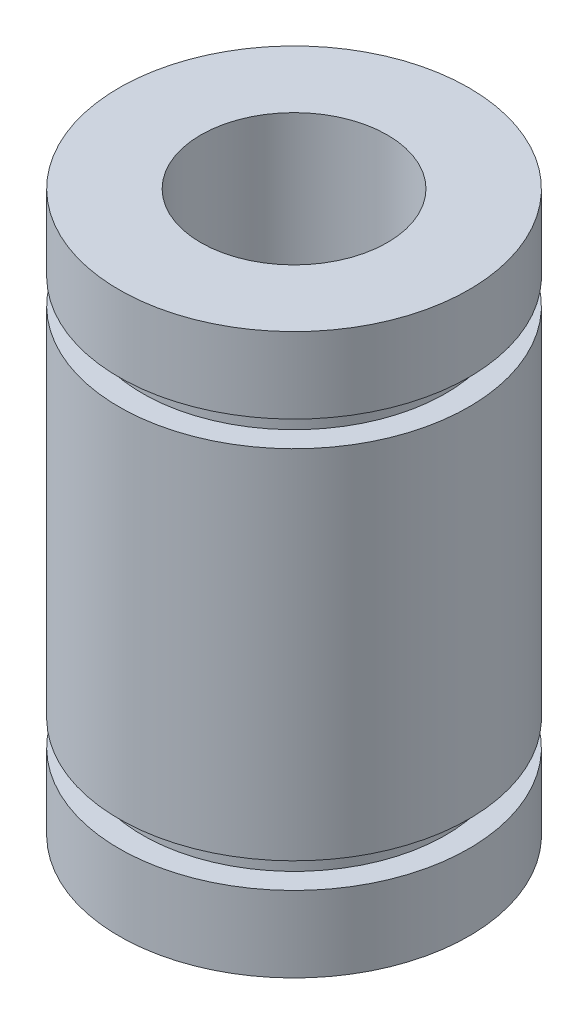
from build123d import *


with BuildPart() as part:
    # Sketch1 → Revolve1 (revolve)
    with BuildSketch(Plane.XY, mode=Mode.PRIVATE) as revolve1_sk:
        Polygon((4, 0), (4, 12), (7.5, 12), (7.5, 8.75), (6.5, 8.75), (6.5, 7.65), (7.5, 7.65), (7.5, 0), align=None)
    revolve1 = revolve(revolve1_sk.sketch.rotate(Axis((0, 0, 0), (0, 1, 0)), 90), axis=Axis((0, 0, 0), (0, 1, 0)))

    # Mirror1: Revolve1 across plane
    add(revolve1.mirror(Plane(origin=(4, 0, 0), x_dir=(0, 0, 1), z_dir=(0, -1, 0))))


solid = part.part
